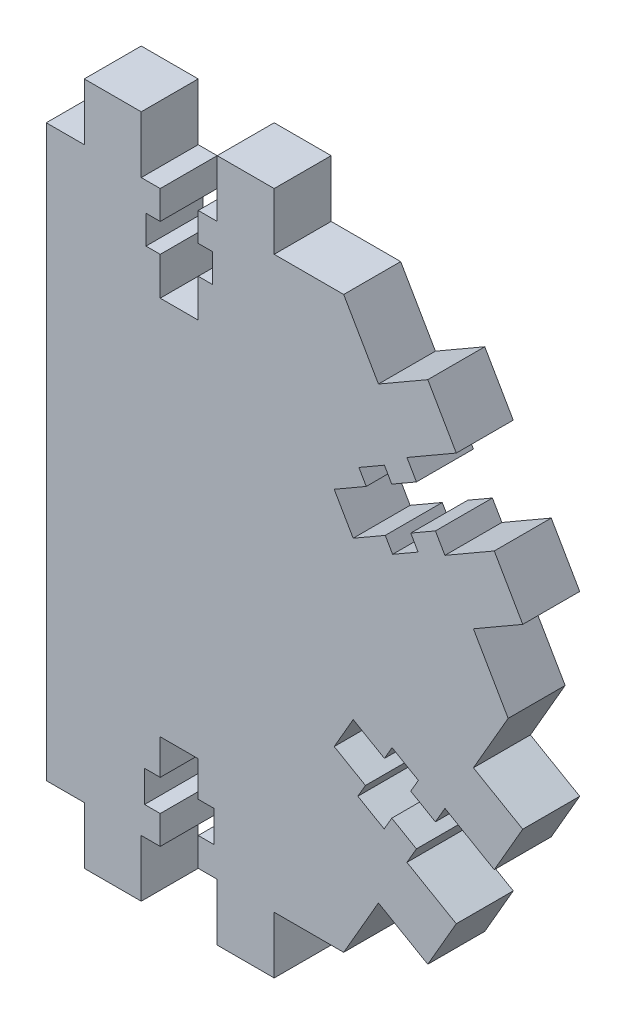
from build123d import *

# Parameters (mm, degrees)
BOSS_EXTRU_1_DEPTH = 6


with BuildPart() as part:
    # Esquisse1 → Boss.-Extru.1 (new body)
    with BuildSketch(Plane.XY):
        Polygon((10, 30), (17.320508076, 30), (20.980762114, 23.660254038), (26.176914536, 26.660254038), (29.176914536, 21.464101615), (23.980762114, 18.464101615), (24.980762114, 16.732050808), (22.382685902, 15.232050808), (21.607685902, 16.574390183), (18.92300715, 15.024390183), (19.69800715, 13.682050808), (16.320508076, 11.732050808), (18.320508076, 8.267949192), (21.69800715, 10.217949192), (22.47300715, 8.875609817), (25.157685902, 10.425609817), (24.382685902, 11.767949192), (26.980762114, 13.267949192), (27.980762114, 11.535898385), (33.176914536, 14.535898385), (36.176914536, 9.339745962), (30.980762114, 6.339745962), (34.641016151, 0), (30.980762114, -6.339745962), (36.176914536, -9.339745962), (33.176914536, -14.535898385), (27.980762114, -11.535898385), (26.980762114, -13.267949192), (24.382685902, -11.767949192), (25.182685902, -10.382308546), (22.41140461, -8.782308546), (21.61140461, -10.167949192), (18.320508076, -8.267949192), (16.320508076, -11.732050808), (19.61140461, -13.632050808), (18.81140461, -15.017691454), (21.582685902, -16.617691454), (22.382685902, -15.232050808), (24.980762114, -16.732050808), (23.980762114, -18.464101615), (29.176914536, -21.464101615), (26.176914536, -26.660254038), (20.980762114, -23.660254038), (17.320508076, -30), (10, -30), (10, -36), (4, -36), (4, -30), (2, -30), (2, -27), (3.65, -27), (3.65, -23.7), (2, -23.7), (2, -20), (-2, -20), (-2, -23.7), (-3.65, -23.7), (-3.65, -27), (-2, -27), (-2, -30), (-4, -30), (-4, -36), (-10, -36), (-10, -30), (-14, -30), (-14, 30), (-10, 30), (-10, 36), (-4, 36), (-4, 30), (-2, 30), (-2, 27), (-3.5, 27), (-3.5, 24), (-2, 24), (-2, 20), (2, 20), (2, 24), (3.5, 24), (3.5, 27), (2, 27), (2, 30), (4, 30), (4, 36), (10, 36), align=None)
    extrude(amount=BOSS_EXTRU_1_DEPTH)


solid = part.part
